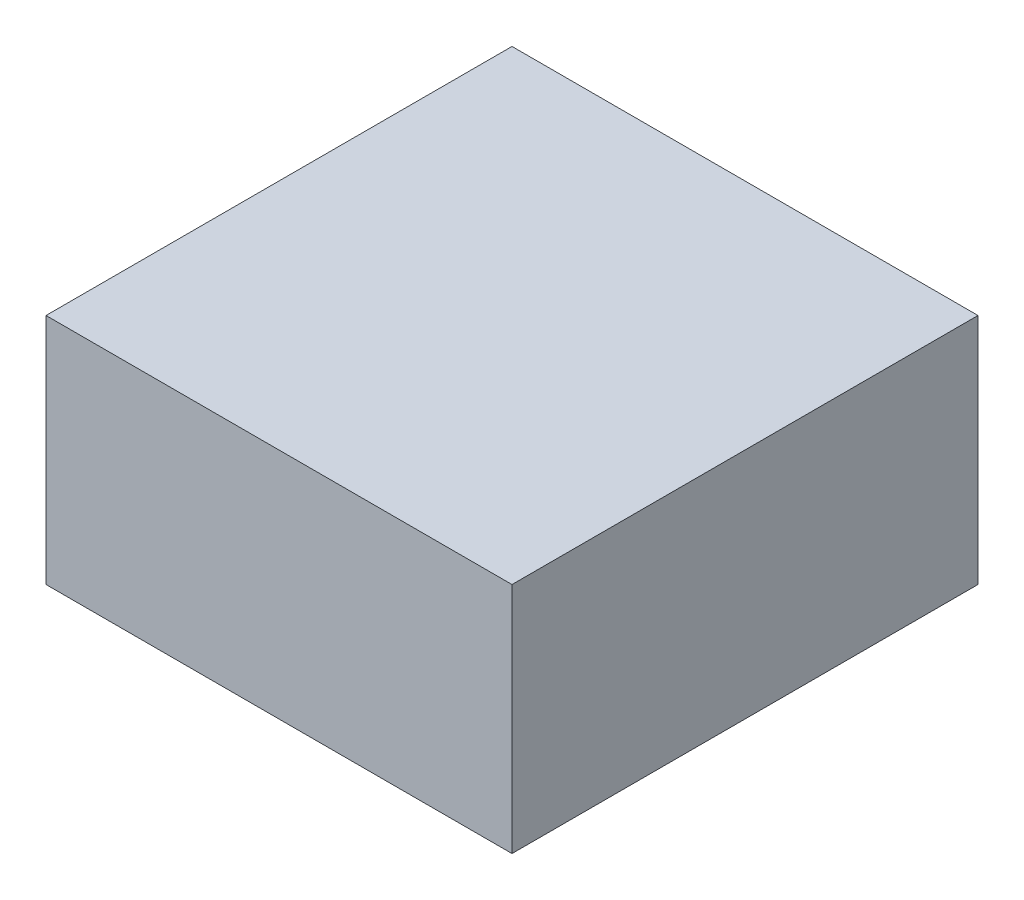
from build123d import *

# Parameters (mm, degrees)
SKETCH1_W           = 304.8
SKETCH1_H           = 304.8
BOSS_EXTRUDE1_DEPTH = 6.35
CUT_EXTRUDE2_DEPTH  = 6.35


with BuildPart() as part:
    # Sketch1 → Boss-Extrude1 (new body)
    with BuildSketch(Plane(origin=(0, 0, 0), x_dir=(1, 0, 0), z_dir=(0, 1, 0))):
        with Locations((152.4, 152.4)):
            Rectangle(SKETCH1_W, SKETCH1_H)
    extrude(amount=BOSS_EXTRUDE1_DEPTH)

    # Sketch2 → Cut-Extrude2 (cut)
    with BuildSketch(Plane(origin=(0, 6.35, 0), x_dir=(1, 0, 0), z_dir=(0, 1, 0))):
        Polygon((12.7, 304.8), (12.7, 292.1), (0, 292.1), (0, 0), (304.8, 0), (304.8, 304.8), align=None)
    extrude(amount=-CUT_EXTRUDE2_DEPTH, mode=Mode.SUBTRACT)


solid = part.part
